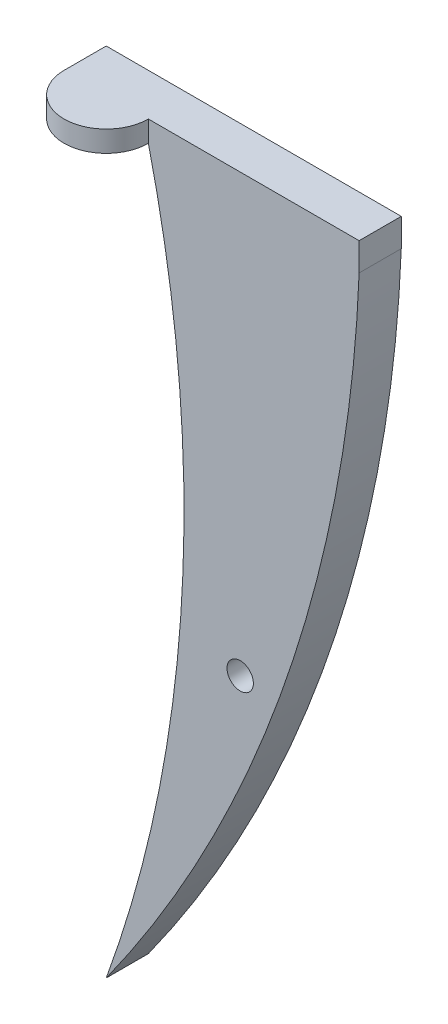
from build123d import *

# Parameters (mm, degrees)
SKETCH1_W           = 35.56
SKETCH1_H           = 5.08
BOSS_EXTRUDE1_DEPTH = 92.202
SKETCH4_W           = 10.16
SKETCH4_H           = 2.54
BOSS_EXTRUDE4_DEPTH = 5.08
CUT_EXTRUDE1_DEPTH  = 2.54
CUT_EXTRUDE3_DEPTH  = 95.037990217
SKETCH13_R          = 1.5875
CUT_EXTRUDE4_DEPTH  = 95.037990217


with BuildPart() as part:
    # Sketch1 → Boss-Extrude1 (new body)
    with BuildSketch(Plane(origin=(0, 0, 0), x_dir=(1, 0, 0), z_dir=(0, 1, 0))):
        Rectangle(SKETCH1_W, SKETCH1_H)
    extrude(amount=BOSS_EXTRUDE1_DEPTH)

    # Sketch4 → Boss-Extrude4 (add)
    with BuildSketch(Plane.XY.offset(2.54)):
        with Locations((-12.7, 90.932)):
            Rectangle(SKETCH4_W, SKETCH4_H)
    extrude(amount=BOSS_EXTRUDE4_DEPTH)

    # Sketch5 → Cut-Extrude1 (cut)
    with BuildSketch(Plane(origin=(0, 92.202, 0), x_dir=(1, 0, 0), z_dir=(0, 1, 0))):
        with BuildLine():
            ThreePointArc((-12.7, -7.62), (-16.292102448, -6.132102448), (-17.78, -2.54))
            Line((-17.78, -2.54), (-17.78, -7.62))
            Line((-17.78, -7.62), (-12.7, -7.62))
        make_face()
        with BuildLine():
            Line((-7.62, -7.62), (-7.62, -2.54))
            ThreePointArc((-7.62, -2.54), (-9.107897552, -6.132102448), (-12.7, -7.62))
            Line((-12.7, -7.62), (-7.62, -7.62))
        make_face()
    extrude(amount=-CUT_EXTRUDE1_DEPTH, mode=Mode.SUBTRACT)

    # Sketch7 → Cut-Extrude3 (cut, through all)
    with BuildSketch(Plane.XY.offset(2.54)):
        with BuildLine():
            ThreePointArc((-12.7, 0), (-3.575035086, 44.457914169), (-7.62, 89.662))
            Line((-7.62, 89.662), (-17.78, 89.662))
            Line((-17.78, 89.662), (-17.78, 0))
            Line((-17.78, 0), (-12.7, 0))
        make_face()
        with BuildLine():
            ThreePointArc((17.78, 88.831864431), (9.052257411, 42.18144567), (-12.7, 0))
            Line((-12.7, 0), (17.78, 0))
            Line((17.78, 0), (17.78, 88.831864431))
        make_face()
    extrude(amount=-CUT_EXTRUDE3_DEPTH, mode=Mode.SUBTRACT)

    # Sketch13 → Cut-Extrude4 (cut, through all)
    with BuildSketch(Plane.XY.offset(2.54)):
        with Locations((3.446895522, 39.620022835)):
            Circle(SKETCH13_R)
    extrude(amount=-CUT_EXTRUDE4_DEPTH, mode=Mode.SUBTRACT)


solid = part.part
